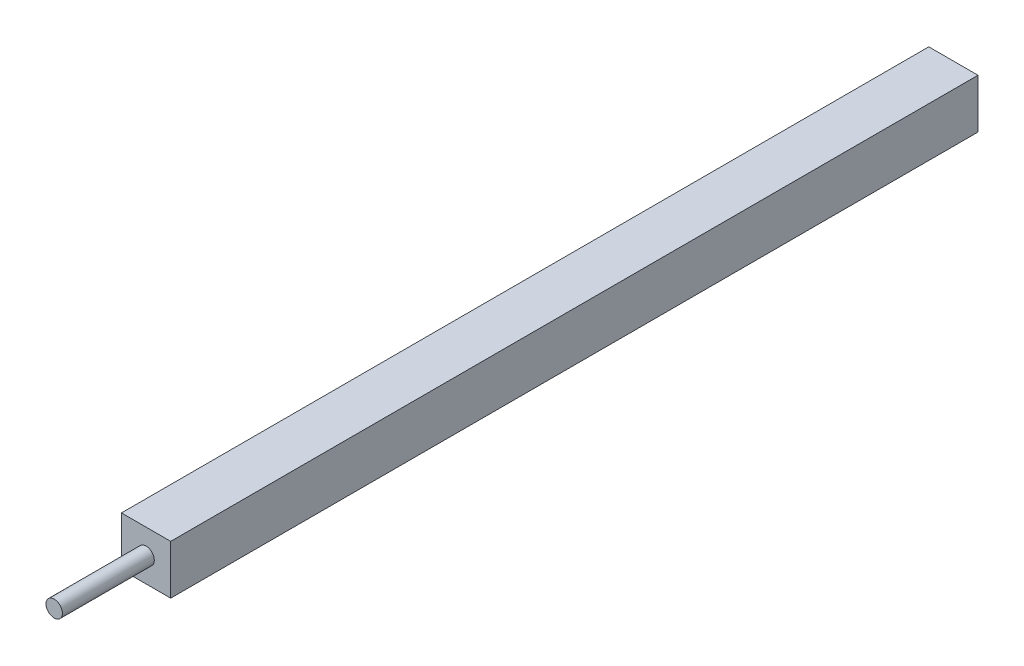
from build123d import *

# Parameters (mm, degrees)
SKETCH_1_W      = 15
SKETCH_1_H      = 15
EXTRUDE_1_DEPTH = 246
SKETCH_2_R      = 2.5
EXTRUDE_2_DEPTH = 28


with BuildPart() as part:
    # 草图1 → 凸台-拉伸1 (new body)
    with BuildSketch(Plane.XY):
        with Locations((7.5, -7.5)):
            Rectangle(SKETCH_1_W, SKETCH_1_H)
    extrude(amount=EXTRUDE_1_DEPTH)

    # 草图2 → 凸台-拉伸2 (add)
    with BuildSketch(Plane.XY.offset(246)):
        with Locations((7.5, -7.5)):
            Circle(SKETCH_2_R)
    extrude(amount=EXTRUDE_2_DEPTH)


solid = part.part
